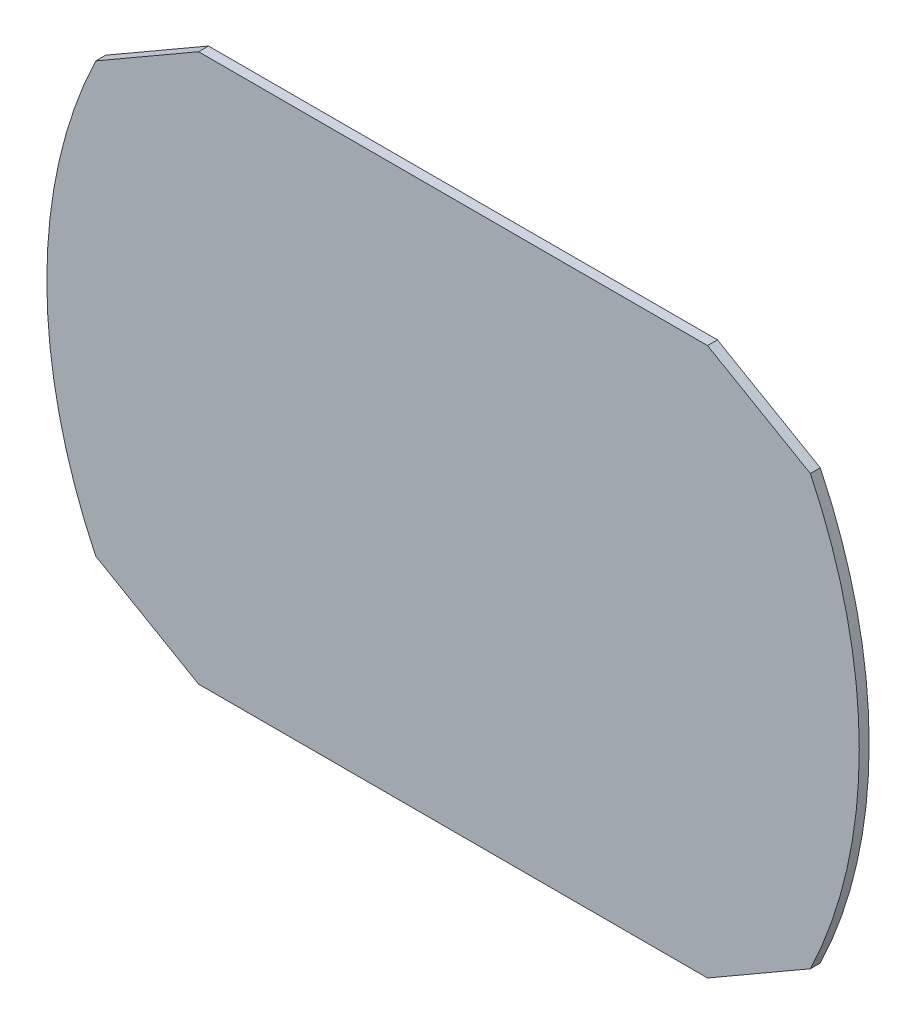
from build123d import *

# Parameters (mm, degrees)
BOSS_EXTRUDE1_DEPTH      = 3
CUT_EXTRUDE21_DEPTH      = 153.533935957
CUT_EXTRUDE21_DEPTH_BACK = 153.533935957
SKETCH34_W               = 3
SKETCH34_H               = 7


with BuildPart() as part:
    # Sketch1 → Boss-Extrude1 (new body)
    with BuildSketch(Plane.XY):
        with BuildLine():
            Line((-65, 90), (-108.301270189, 65))
            ThreePointArc((-108.301270189, 65), (-123.116211843, 0), (-108.301270189, -65))
            Line((-108.301270189, -65), (-65, -90))
            Line((-65, -90), (65, -90))
            Line((65, -90), (108.301270189, -65))
            ThreePointArc((108.301270189, -65), (123.116211843, 0), (108.301270189, 65))
            Line((108.301270189, 65), (65, 90))
            Line((65, 90), (-65, 90))
        make_face()
    extrude(amount=BOSS_EXTRUDE1_DEPTH)

    # Sketch34 → Cut-Extrude21 (cut, two sides: drawn at the far end of the back side and taken through both)
    with BuildSketch(Plane(origin=(0, 0, 0), x_dir=(0, 0, -1), z_dir=(1, 0, 0)).offset(-CUT_EXTRUDE21_DEPTH_BACK)):
        with Locations((-1.5, 86.5)):
            Rectangle(SKETCH34_W, SKETCH34_H)
        with Locations((-1.5, -86.5)):
            Rectangle(SKETCH34_W, SKETCH34_H)
    extrude(amount=CUT_EXTRUDE21_DEPTH + CUT_EXTRUDE21_DEPTH_BACK, mode=Mode.SUBTRACT)


solid = part.part
